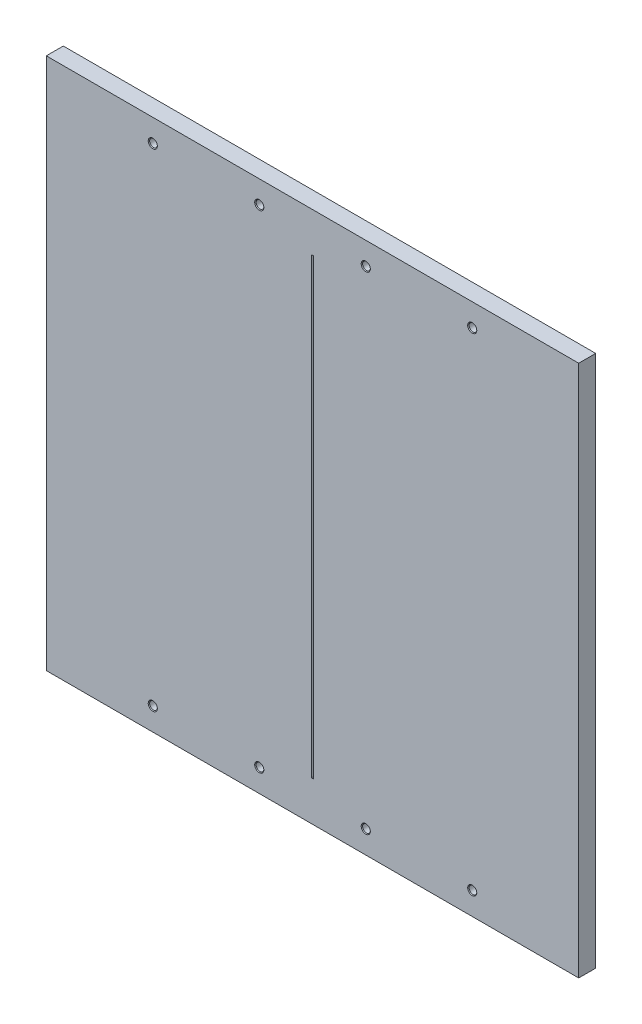
from build123d import *

# Parameters (mm, degrees)
SCHIZZO1_W                      = 470
SCHIZZO1_H                      = 470
ESTRUSIONE_ESTRUSIONE1_DEPTH    = 15
FORO_FILETTATO_M8_1_D           = 6.8
FORO_FILETTATO_M8_1_DEPTH       = 22.25
FORO_FILETTATO_M8_1_CSINK_D     = 8.05
FORO_FILETTATO_M8_1_CSINK_ANGLE = 90
FORO_FILETTATO_M8_1_TIP         = 2.042926105
SCHIZZO11_W                     = 2
SCHIZZO11_H                     = 400
TAGLIO_ESTRUSIONE1_DEPTH        = 5


with BuildPart() as part:
    # Schizzo1 → Estrusione-Estrusione1 (new body)
    with BuildSketch(Plane.XY):
        Rectangle(SCHIZZO1_W, SCHIZZO1_H)
    extrude(amount=ESTRUSIONE_ESTRUSIONE1_DEPTH)

    # Foro filettato M8-1
    with Locations(Plane.XY.offset(15)):
        with Locations((-141, 215), (-47, 215), (47, 215), (141, 215), (-141, -215), (-47, -215), (141, -215), (47, -215)):
            CounterSinkHole(FORO_FILETTATO_M8_1_D / 2, FORO_FILETTATO_M8_1_CSINK_D / 2, depth=FORO_FILETTATO_M8_1_DEPTH, counter_sink_angle=FORO_FILETTATO_M8_1_CSINK_ANGLE)
            with Locations((0, 0, -(FORO_FILETTATO_M8_1_DEPTH + FORO_FILETTATO_M8_1_TIP / 2))):  # 118° drill point
                Cone(0, FORO_FILETTATO_M8_1_D / 2, FORO_FILETTATO_M8_1_TIP, mode=Mode.SUBTRACT)

    # Schizzo11 → Taglio-Estrusione1 (cut)
    with BuildSketch(Plane.XY.offset(15)):
        Rectangle(SCHIZZO11_W, SCHIZZO11_H)
    extrude(amount=-TAGLIO_ESTRUSIONE1_DEPTH, mode=Mode.SUBTRACT)


solid = part.part
